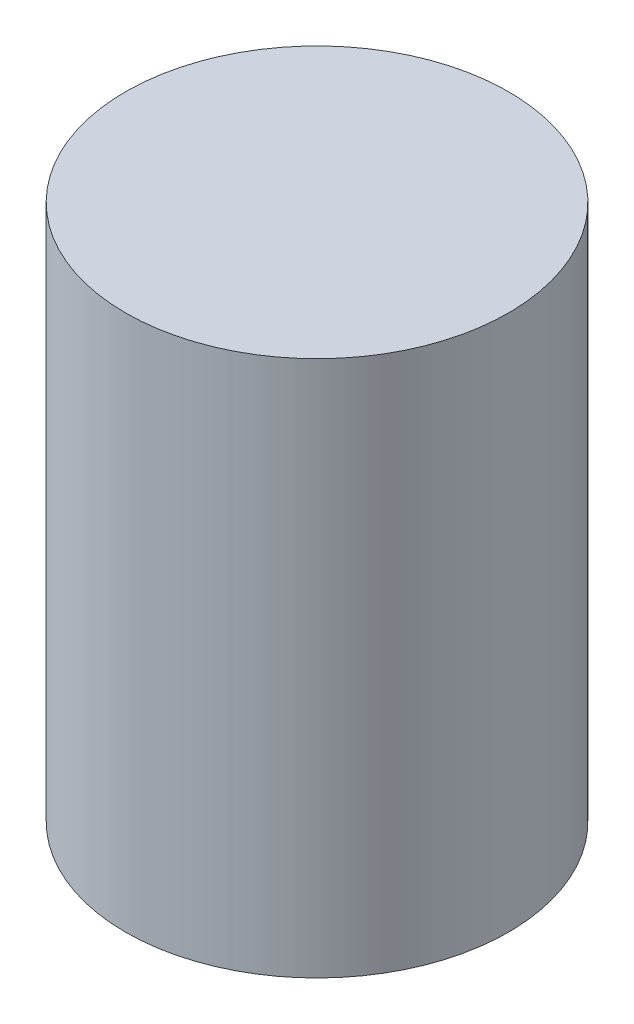
from build123d import *

# Parameters (mm, degrees)
SKETCH1_R           = 25
BOSS_EXTRUDE1_DEPTH = 70


with BuildPart() as part:
    # Sketch1 → Boss-Extrude1 (new body)
    with BuildSketch(Plane(origin=(0, 0, 0), x_dir=(1, 0, 0), z_dir=(0, 1, 0))):
        with Locations(Location((0, 0, 0), (0, 0, 270))):
            Circle(SKETCH1_R)
    extrude(amount=BOSS_EXTRUDE1_DEPTH)


solid = part.part
